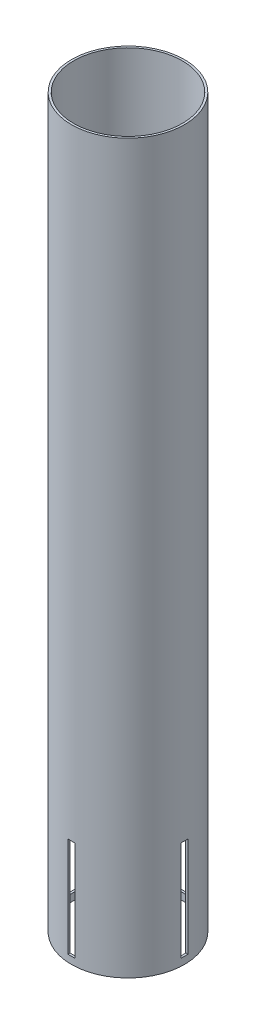
from build123d import *

# Parameters (mm, degrees)
SKETCH1_R           = 39.6
SKETCH1_R_2         = 38.1
BOSS_EXTRUDE1_DEPTH = 510
SKETCH2_W           = 5
SKETCH2_H           = 70
CUT_EXTRUDE1_DEPTH  = 514.06560984
CIRPATTERN1_COUNT   = 4


with BuildPart() as part:
    # Sketch1 → Boss-Extrude1 (new body)
    with BuildSketch(Plane(origin=(0, 0, 0), x_dir=(1, 0, 0), z_dir=(0, 1, 0))):
        with Locations(Location((0, 0, 0), (0, 0, 270))):
            Circle(SKETCH1_R)
        with Locations(Location((0, 0, 0), (0, 0, 270))):
            Circle(SKETCH1_R_2, mode=Mode.SUBTRACT)
    extrude(amount=BOSS_EXTRUDE1_DEPTH)

    # Sketch2 → Cut-Extrude1 (cut, through all)
    with BuildSketch(Plane.XY):
        with Locations((0, 40)):
            Rectangle(SKETCH2_W, SKETCH2_H)
    cut_extrude1 = extrude(amount=-CUT_EXTRUDE1_DEPTH, mode=Mode.SUBTRACT)

    # CirPattern1: Cut-Extrude1 ×4 about axis
    cirpattern1_axis = Axis((0, 0, 0), (0, 1, 0))
    for i in range(1, CIRPATTERN1_COUNT):
        add(cut_extrude1.rotate(cirpattern1_axis, i * 360 / CIRPATTERN1_COUNT), mode=Mode.SUBTRACT)


solid = part.part
